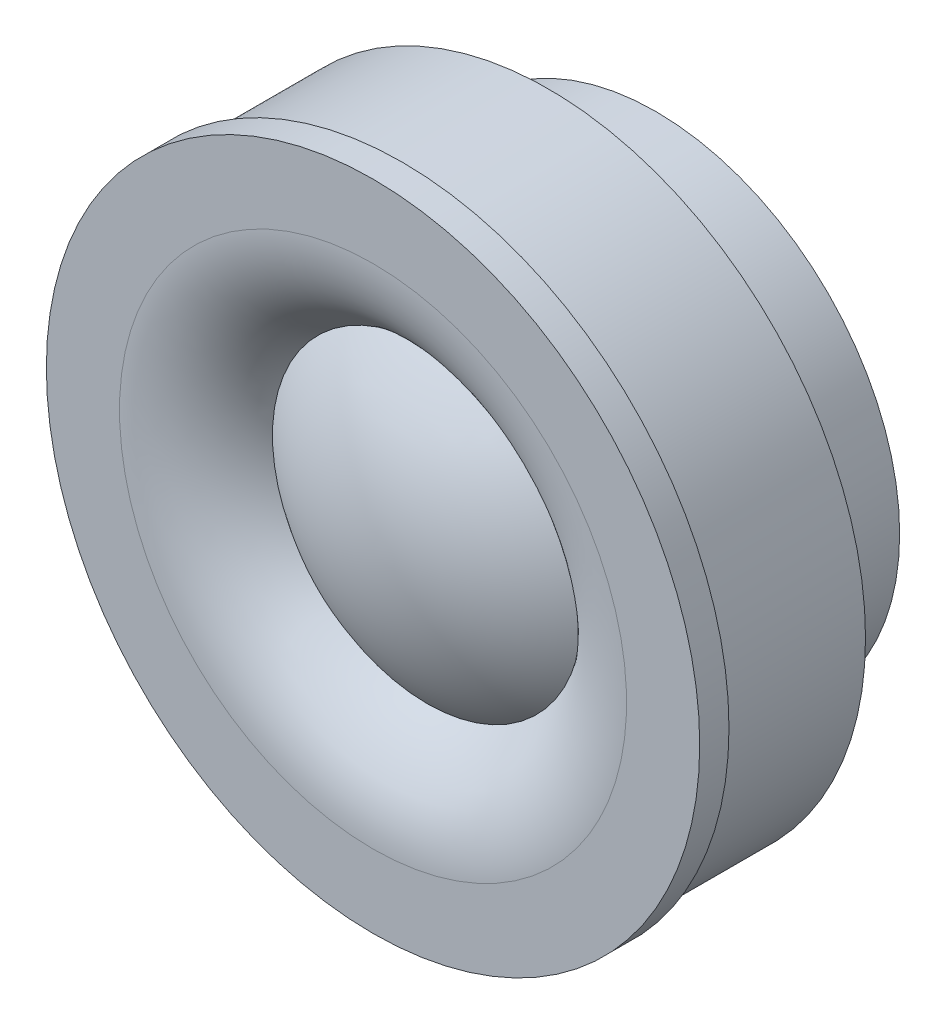
from build123d import *

# Parameters (mm, degrees)
SKETCH1_R           = 16.25
BOSS_EXTRUDE1_DEPTH = 9
SKETCH2_R           = 12.5
BOSS_EXTRUDE3_DEPTH = 5.5
SKETCH3_R           = 16.75
BOSS_EXTRUDE4_DEPTH = 1.5


with BuildPart() as part:
    # Sketch1 → Boss-Extrude1 (new body)
    with BuildSketch(Plane.XY):
        Circle(SKETCH1_R)
    extrude(amount=-BOSS_EXTRUDE1_DEPTH)

    # Sketch2 → Boss-Extrude3 (add)
    with BuildSketch(Plane(origin=(0, 0, -9), x_dir=(-1, 0, 0), z_dir=(0, 0, -1))):
        with Locations(Location((0, 0, 0), (0, 0, 180))):
            Circle(SKETCH2_R)
    extrude(amount=BOSS_EXTRUDE3_DEPTH)

    # Sketch3 → Boss-Extrude4 (add)
    with BuildSketch(Plane.XY):
        Circle(SKETCH3_R)
    extrude(amount=-BOSS_EXTRUDE4_DEPTH)

    # Sketch5 → Cut-Revolve4 (revolve, cut)
    with BuildSketch(Plane(origin=(0, 0, 0), x_dir=(0, 0, -1), z_dir=(1, 0, 0)), mode=Mode.PRIVATE) as cut_revolve4_sk:
        with BuildLine():
            Line((0, 13), (-11.197865554, 13))
            Line((-11.197865554, 13), (-11.197865554, 0))
            Line((-11.197865554, 0), (0, 0))
            ThreePointArc((0, 0), (0.714984963, 4.205055913), (2.779581743, 7.9375))
            ThreePointArc((2.779581743, 7.9375), (0.740603193, 10.112311438), (0, 13))
        make_face()
    revolve(cut_revolve4_sk.sketch.rotate(Axis((0, 0, 11.197865554), (0, 0, -1)), 180), axis=Axis((0, 0, 11.197865554), (0, 0, -1)), mode=Mode.SUBTRACT)


solid = part.part
